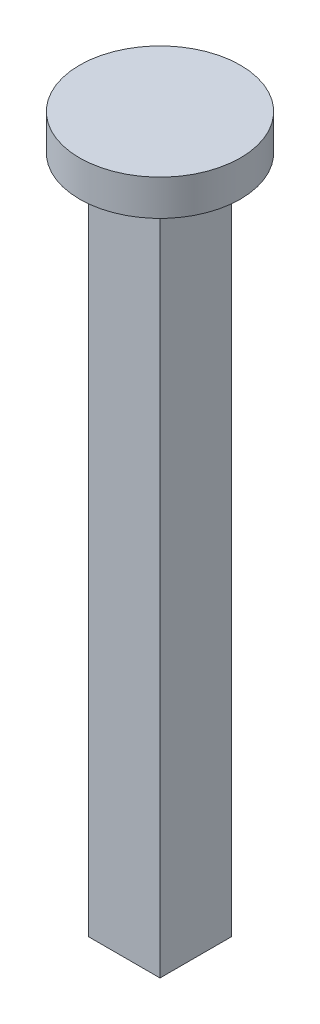
from build123d import *

# Parameters (mm, degrees)
SKETCH1_W           = 20
SKETCH1_H           = 200
BOSS_EXTRUDE1_DEPTH = 20
SKETCH4_R           = 22.5
BOSS_EXTRUDE3_DEPTH = 10


with BuildPart() as part:
    # Sketch1 → Boss-Extrude1 (new body)
    with BuildSketch(Plane.XY):
        Rectangle(SKETCH1_W, SKETCH1_H)
    extrude(amount=BOSS_EXTRUDE1_DEPTH)

    # Sketch4 → Boss-Extrude3 (add)
    with BuildSketch(Plane(origin=(0, 100, 0), x_dir=(1, 0, 0), z_dir=(0, 1, 0))):
        with Locations(Location((0, -10, 0), (0, 0, 270))):
            Circle(SKETCH4_R)
    extrude(amount=-BOSS_EXTRUDE3_DEPTH)


solid = part.part
